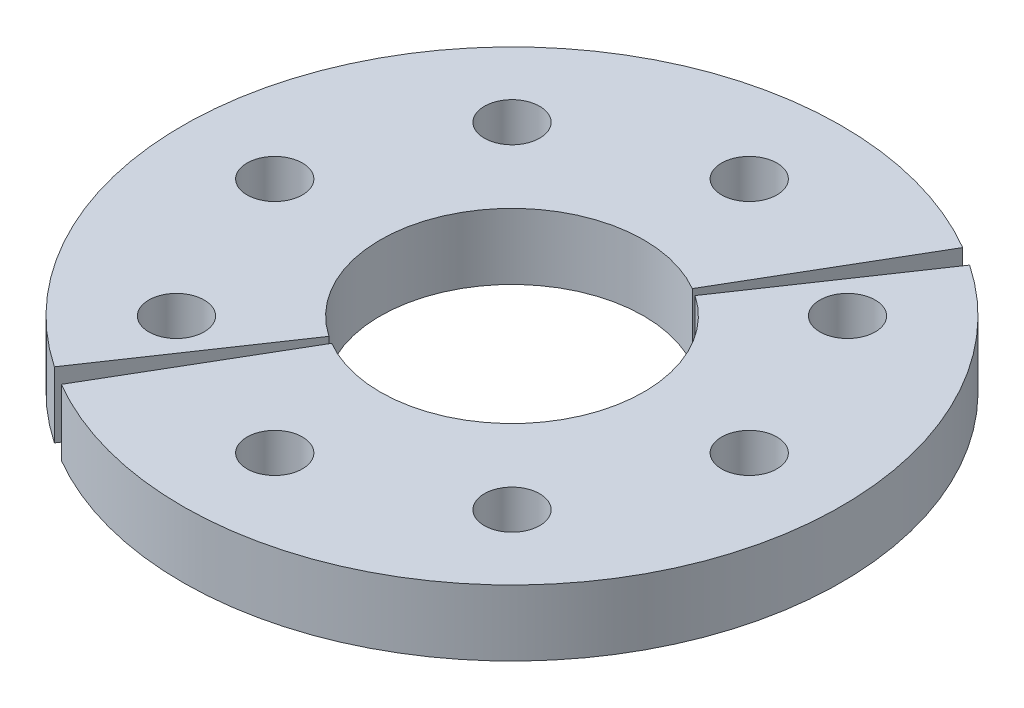
from build123d import *

# Parameters (mm, degrees)
SKETCH_1_R        = 2.1
EXTRUDE_2_DEPTH   = 5
EXTRUDE_2_2_DEPTH = 5


with BuildPart() as part:
    # Эскиз1 → Бобышка-Вытянуть2 (new body)
    with BuildSketch(Plane(origin=(0, 0, 0), x_dir=(1, 0, 0), z_dir=(0, 1, 0))):
        with BuildLine():
            Line((-14.015859913, -20.701586193), (-5.606343965, -8.280634477))
            ThreePointArc((-5.606343965, -8.280634477), (-8.46332743, 5.326545673), (5.040799558, 8.63656991))
            Line((5.040799558, 8.63656991), (12.601998896, 21.591424775))
            ThreePointArc((12.601998896, 21.591424775), (-21.158318575, 13.316364183), (-14.015859913, -20.701586193))
        make_face()
        with Locations(Location((-12.727922061, -12.727922061, 0), (0, 0, 270))):
            Circle(SKETCH_1_R, mode=Mode.SUBTRACT)
        with Locations(Location((-18, 0, 0), (0, 0, 270))):
            Circle(SKETCH_1_R, mode=Mode.SUBTRACT)
        with Locations(Location((-12.727922061, 12.727922061, 0), (0, 0, 270))):
            Circle(SKETCH_1_R, mode=Mode.SUBTRACT)
        with Locations(Location((0, 18, 0), (0, 0, 270))):
            Circle(SKETCH_1_R, mode=Mode.SUBTRACT)
    extrude(amount=EXTRUDE_2_DEPTH)


with BuildPart() as body_2:
    # Эскиз1 → Extrude 2 2 (new body)
    with BuildSketch(Plane(origin=(0, 0, 0), x_dir=(1, 0, 0), z_dir=(0, 1, 0))):
        with BuildLine():
            ThreePointArc((10, 0), (4.979558435, -8.672023858), (-5.040799558, -8.63656991))
            Line((-5.040799558, -8.63656991), (-12.601998896, -21.591424775))
            ThreePointArc((-12.601998896, -21.591424775), (12.448896088, -21.680059645), (25, 0))
            ThreePointArc((25, 0), (22.083891163, 11.717582988), (14.015859913, 20.701586193))
            Line((14.015859913, 20.701586193), (5.606343965, 8.280634477))
            ThreePointArc((5.606343965, 8.280634477), (8.833556465, 4.687033195), (10, 0))
        make_face()
        with Locations(Location((0, -18, 0), (0, 0, 270))):
            Circle(SKETCH_1_R, mode=Mode.SUBTRACT)
        with Locations(Location((12.727922061, -12.727922061, 0), (0, 0, 270))):
            Circle(SKETCH_1_R, mode=Mode.SUBTRACT)
        with Locations(Location((18, 0, 0), (0, 0, 270))):
            Circle(SKETCH_1_R, mode=Mode.SUBTRACT)
        with Locations(Location((12.727922061, 12.727922061, 0), (0, 0, 270))):
            Circle(SKETCH_1_R, mode=Mode.SUBTRACT)
    extrude(amount=EXTRUDE_2_2_DEPTH)


solid = Compound([part.part, body_2.part])
